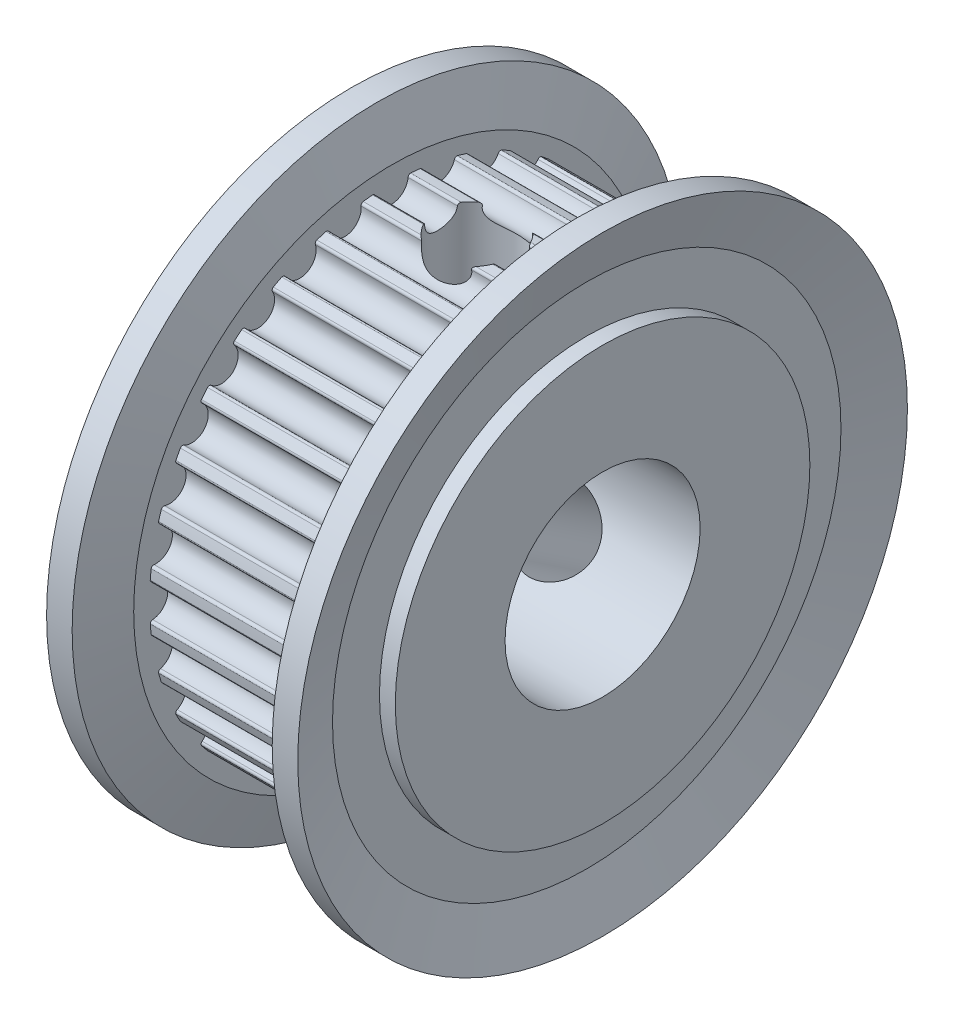
from build123d import *

# Parameters (mm, degrees)
CUT_EXTRUDE1_DEPTH       = 3.5
CUT_EXTRUDE1_DEPTH_BACK  = 3.5
CUT_EXTRUDE2_DEPTH       = 3.5
CUT_EXTRUDE2_DEPTH_BACK  = 3.5
CUT_EXTRUDE3_DEPTH       = 3.5
CUT_EXTRUDE3_DEPTH_BACK  = 3.5
CUT_EXTRUDE4_DEPTH       = 3.5
CUT_EXTRUDE4_DEPTH_BACK  = 3.5
CUT_EXTRUDE5_DEPTH       = 3.5
CUT_EXTRUDE5_DEPTH_BACK  = 3.5
CUT_EXTRUDE6_DEPTH       = 3.5
CUT_EXTRUDE6_DEPTH_BACK  = 3.5
CUT_EXTRUDE7_DEPTH       = 3.5
CUT_EXTRUDE7_DEPTH_BACK  = 3.5
CUT_EXTRUDE8_DEPTH       = 3.5
CUT_EXTRUDE8_DEPTH_BACK  = 3.5
CUT_EXTRUDE9_DEPTH       = 3.5
CUT_EXTRUDE9_DEPTH_BACK  = 3.5
CUT_EXTRUDE10_DEPTH      = 3.5
CUT_EXTRUDE10_DEPTH_BACK = 3.5
CUT_EXTRUDE11_DEPTH      = 3.5
CUT_EXTRUDE11_DEPTH_BACK = 3.5
CUT_EXTRUDE12_DEPTH      = 3.5
CUT_EXTRUDE12_DEPTH_BACK = 3.5
CUT_EXTRUDE13_DEPTH      = 3.5
CUT_EXTRUDE13_DEPTH_BACK = 3.5
CUT_EXTRUDE14_DEPTH      = 3.5
CUT_EXTRUDE14_DEPTH_BACK = 3.5
CUT_EXTRUDE15_DEPTH      = 3.5
CUT_EXTRUDE15_DEPTH_BACK = 3.5
CUT_EXTRUDE16_DEPTH      = 3.5
CUT_EXTRUDE16_DEPTH_BACK = 3.5
CUT_EXTRUDE17_DEPTH      = 3.5
CUT_EXTRUDE17_DEPTH_BACK = 3.5
CUT_EXTRUDE18_DEPTH      = 3.5
CUT_EXTRUDE18_DEPTH_BACK = 3.5
CUT_EXTRUDE19_DEPTH      = 3.5
CUT_EXTRUDE19_DEPTH_BACK = 3.5
CUT_EXTRUDE20_DEPTH      = 3.5
CUT_EXTRUDE20_DEPTH_BACK = 3.5
CUT_EXTRUDE21_DEPTH      = 3.5
CUT_EXTRUDE21_DEPTH_BACK = 3.5
CUT_EXTRUDE22_DEPTH      = 3.5
CUT_EXTRUDE22_DEPTH_BACK = 3.5
CUT_EXTRUDE23_DEPTH      = 3.5
CUT_EXTRUDE23_DEPTH_BACK = 3.5
CUT_EXTRUDE24_DEPTH      = 3.5
CUT_EXTRUDE24_DEPTH_BACK = 3.5
CUT_EXTRUDE25_DEPTH      = 3.5
CUT_EXTRUDE25_DEPTH_BACK = 3.5
CUT_EXTRUDE26_DEPTH      = 3.5
CUT_EXTRUDE26_DEPTH_BACK = 3.5
CUT_EXTRUDE27_DEPTH      = 3.5
CUT_EXTRUDE27_DEPTH_BACK = 3.5
CUT_EXTRUDE28_DEPTH      = 3.5
CUT_EXTRUDE28_DEPTH_BACK = 3.5
CUT_EXTRUDE29_DEPTH      = 3.5
CUT_EXTRUDE29_DEPTH_BACK = 3.5
CUT_EXTRUDE30_DEPTH      = 3.5
CUT_EXTRUDE30_DEPTH_BACK = 3.5
CUT_EXTRUDE31_DEPTH      = 3.5
CUT_EXTRUDE31_DEPTH_BACK = 3.5
CUT_EXTRUDE32_DEPTH      = 3.5
CUT_EXTRUDE32_DEPTH_BACK = 3.5
SKETCH36_W               = 10.3
SKETCH36_H               = 4
SKETCH37_W               = 1.621
SKETCH37_H               = 9.93


with BuildPart() as part:
    # Sketch1 → Revolve1 (revolve)
    with BuildSketch(Plane.XY, mode=Mode.PRIVATE) as revolve1_sk:
        Polygon((-5.15, 0), (-5.15, 8.5), (-3.5, 8.5), (-3.5, 9.93), (3.5, 9.93), (3.5, 8.5), (5.15, 8.5), (5.15, 0), align=None)
    revolve(revolve1_sk.sketch.rotate(Axis((5.15, 0, 0), (-1, 0, 0)), 270), axis=Axis((5.15, 0, 0), (-1, 0, 0)))

    # Sketch2 → Cut-Extrude1 (cut, two sides: drawn at the far end of the back side and taken through both)
    with BuildSketch(Plane(origin=(0, 0, 0), x_dir=(0, 0, -1), z_dir=(1, 0, 0)).offset(-CUT_EXTRUDE1_DEPTH_BACK)):
        with BuildLine():
            Line((-0.950908352, 10.140512724), (-0.927279331, 9.888532197))
            Line((-0.927279331, 9.888532197), (-0.792969158, 9.89929093))
            ThreePointArc((-0.792969158, 9.89929093), (-0.711706778, 9.873169891), (-0.672449407, 9.797375816))
            ThreePointArc((-0.672449407, 9.797375816), (-2e-09, 9.181), (0.672449407, 9.797375812))
            ThreePointArc((0.672449407, 9.797375812), (0.711706777, 9.87316989), (0.792969158, 9.89929093))
            Line((0.792969158, 9.89929093), (0.927279331, 9.888532197))
            Line((0.927279331, 9.888532197), (0.950908352, 10.140512724))
            ThreePointArc((0.950908352, 10.140512724), (0, 10.185), (-0.950908352, 10.140512724))
        make_face()
    extrude(amount=CUT_EXTRUDE1_DEPTH + CUT_EXTRUDE1_DEPTH_BACK, mode=Mode.SUBTRACT)

    # Sketch3 → Cut-Extrude2 (cut, two sides: drawn at the far end of the back side and taken through both)
    with BuildSketch(Plane(origin=(0, 0, 0), x_dir=(0, 0, -1), z_dir=(1, 0, 0)).offset(-CUT_EXTRUDE2_DEPTH_BACK)):
        with BuildLine():
            Line((-2.910952807, 9.760152599), (-2.838618849, 9.5176236))
            Line((-2.838618849, 9.5176236), (-2.708988333, 9.554378222))
            ThreePointArc((-2.708988333, 9.554378222), (-2.624191426, 9.544612596), (-2.570901683, 9.477933616))
            ThreePointArc((-2.570901683, 9.477933616), (-1.791124249, 9.004589659), (-1.251844722, 9.740310354))
            ThreePointArc((-1.251844722, 9.740310354), (-1.228128363, 9.822306803), (-1.153523377, 9.863779439))
            Line((-1.153523377, 9.863779439), (-1.019695012, 9.879430047))
            Line((-1.019695012, 9.879430047), (-1.045678978, 10.131178632))
            ThreePointArc((-1.045678978, 10.131178632), (-1.98699493, 9.989298081), (-2.910952807, 9.760152599))
        make_face()
    extrude(amount=CUT_EXTRUDE2_DEPTH + CUT_EXTRUDE2_DEPTH_BACK, mode=Mode.SUBTRACT)

    # Sketch4 → Cut-Extrude3 (cut, two sides: drawn at the far end of the back side and taken through both)
    with BuildSketch(Plane(origin=(0, 0, 0), x_dir=(0, 0, -1), z_dir=(1, 0, 0)).offset(-CUT_EXTRUDE3_DEPTH_BACK)):
        with BuildLine():
            Line((-4.759130979, 9.004715283), (-4.640871837, 8.780958066))
            Line((-4.640871837, 8.780958066), (-4.520902606, 8.842296117))
            ThreePointArc((-4.520902606, 8.842296117), (-4.435829868, 8.849261191), (-4.370555649, 8.794259742))
            ThreePointArc((-4.370555649, 8.794259742), (-3.513416595, 8.482137987), (-3.12803116, 9.308930232))
            ThreePointArc((-3.12803116, 9.308930232), (-3.120767218, 9.393977974), (-3.055686656, 9.449208436))
            Line((-3.055686656, 9.449208436), (-2.927483047, 9.490666941))
            Line((-2.927483047, 9.490666941), (-3.002081451, 9.732509027))
            ThreePointArc((-3.002081451, 9.732509027), (-3.897630759, 9.409713039), (-4.759130979, 9.004715283))
        make_face()
    extrude(amount=CUT_EXTRUDE3_DEPTH + CUT_EXTRUDE3_DEPTH_BACK, mode=Mode.SUBTRACT)

    # Sketch5 → Cut-Extrude4 (cut, two sides: drawn at the far end of the back side and taken through both)
    with BuildSketch(Plane(origin=(0, 0, 0), x_dir=(0, 0, -1), z_dir=(1, 0, 0)).offset(-CUT_EXTRUDE4_DEPTH_BACK)):
        with BuildLine():
            Line((-6.424418416, 7.903231808), (-6.264778723, 7.706845238))
            Line((-6.264778723, 7.706845238), (-6.159081127, 7.790409532))
            ThreePointArc((-6.159081127, 7.790409532), (-6.077001856, 7.813837641), (-6.002251613, 7.772627398))
            ThreePointArc((-6.002251613, 7.772627398), (-5.100690311, 7.633722509), (-4.884009115, 8.519813141))
            ThreePointArc((-4.884009115, 8.519813141), (-4.893476739, 8.60464384), (-4.84042161, 8.671509651))
            Line((-4.84042161, 8.671509651), (-4.722769551, 8.737182826))
            Line((-4.722769551, 8.737182826), (-4.843115618, 8.959824558))
            ThreePointArc((-4.843115618, 8.959824558), (-5.658482823, 8.468518001), (-6.424418416, 7.903231808))
        make_face()
    extrude(amount=CUT_EXTRUDE4_DEPTH + CUT_EXTRUDE4_DEPTH_BACK, mode=Mode.SUBTRACT)

    # Sketch6 → Cut-Extrude5 (cut, two sides: drawn at the far end of the back side and taken through both)
    with BuildSketch(Plane(origin=(0, 0, 0), x_dir=(0, 0, -1), z_dir=(1, 0, 0)).offset(-CUT_EXTRUDE5_DEPTH_BACK)):
        with BuildLine():
            Line((-7.842819056, 6.498031568), (-7.647933676, 6.33656267))
            Line((-7.647933676, 6.33656267), (-7.560569614, 6.439141876))
            ThreePointArc((-7.560569614, 6.439141876), (-7.484638071, 6.478132693), (-7.403284413, 6.452297342))
            ThreePointArc((-7.403284413, 6.452297342), (-6.49194736, 6.491947357), (-6.452297339, 7.40328441))
            ThreePointArc((-6.452297339, 7.40328441), (-6.478132693, 7.484638069), (-6.439141876, 7.560569614))
            Line((-6.439141876, 7.560569614), (-6.33656267, 7.647933676))
            Line((-6.33656267, 7.647933676), (-6.498031568, 7.842819056))
            ThreePointArc((-6.498031568, 7.842819056), (-7.201882566, 7.201882566), (-7.842819056, 6.498031568))
        make_face()
    extrude(amount=CUT_EXTRUDE5_DEPTH + CUT_EXTRUDE5_DEPTH_BACK, mode=Mode.SUBTRACT)

    # Sketch7 → Cut-Extrude6 (cut, two sides: drawn at the far end of the back side and taken through both)
    with BuildSketch(Plane(origin=(0, 0, 0), x_dir=(0, 0, -1), z_dir=(1, 0, 0)).offset(-CUT_EXTRUDE6_DEPTH_BACK)):
        with BuildLine():
            Line((-8.959824558, 4.843115618), (-8.737182826, 4.722769551))
            Line((-8.737182826, 4.722769551), (-8.671509651, 4.84042161))
            ThreePointArc((-8.671509651, 4.84042161), (-8.604643842, 4.893476738), (-8.519813145, 4.884009117))
            ThreePointArc((-8.519813145, 4.884009117), (-7.633722512, 5.100690308), (-7.772627394, 6.00225161))
            ThreePointArc((-7.772627394, 6.00225161), (-7.813837641, 6.077001854), (-7.790409532, 6.159081127))
            Line((-7.790409532, 6.159081127), (-7.706845238, 6.264778723))
            Line((-7.706845238, 6.264778723), (-7.903231808, 6.424418416))
            ThreePointArc((-7.903231808, 6.424418416), (-8.468518001, 5.658482823), (-8.959824558, 4.843115618))
        make_face()
    extrude(amount=CUT_EXTRUDE6_DEPTH + CUT_EXTRUDE6_DEPTH_BACK, mode=Mode.SUBTRACT)

    # Sketch8 → Cut-Extrude7 (cut, two sides: drawn at the far end of the back side and taken through both)
    with BuildSketch(Plane(origin=(0, 0, 0), x_dir=(0, 0, -1), z_dir=(1, 0, 0)).offset(-CUT_EXTRUDE7_DEPTH_BACK)):
        with BuildLine():
            Line((-9.732509027, 3.002081451), (-9.490666941, 2.927483047))
            Line((-9.490666941, 2.927483047), (-9.449208436, 3.055686656))
            ThreePointArc((-9.449208436, 3.055686656), (-9.393977976, 3.120767217), (-9.308930236, 3.128031162))
            ThreePointArc((-9.308930236, 3.128031162), (-8.482137989, 3.513416591), (-8.794259738, 4.370555647))
            ThreePointArc((-8.794259738, 4.370555647), (-8.84926119, 4.435829866), (-8.842296117, 4.520902606))
            Line((-8.842296117, 4.520902606), (-8.780958066, 4.640871837))
            Line((-8.780958066, 4.640871837), (-9.004715283, 4.759130979))
            ThreePointArc((-9.004715283, 4.759130979), (-9.409713039, 3.897630759), (-9.732509027, 3.002081451))
        make_face()
    extrude(amount=CUT_EXTRUDE7_DEPTH + CUT_EXTRUDE7_DEPTH_BACK, mode=Mode.SUBTRACT)

    # Sketch9 → Cut-Extrude8 (cut, two sides: drawn at the far end of the back side and taken through both)
    with BuildSketch(Plane(origin=(0, 0, 0), x_dir=(0, 0, -1), z_dir=(1, 0, 0)).offset(-CUT_EXTRUDE8_DEPTH_BACK)):
        with BuildLine():
            Line((-10.131178632, 1.045678978), (-9.879430047, 1.019695012))
            Line((-9.879430047, 1.019695012), (-9.863779439, 1.153523377))
            ThreePointArc((-9.863779439, 1.153523377), (-9.822306805, 1.228128361), (-9.740310358, 1.251844723))
            ThreePointArc((-9.740310358, 1.251844723), (-9.00458966, 1.791124244), (-9.477933611, 2.570901682))
            ThreePointArc((-9.477933611, 2.570901682), (-9.544612594, 2.624191424), (-9.554378222, 2.708988333))
            Line((-9.554378222, 2.708988333), (-9.5176236, 2.838618849))
            Line((-9.5176236, 2.838618849), (-9.760152599, 2.910952807))
            ThreePointArc((-9.760152599, 2.910952807), (-9.989298081, 1.98699493), (-10.131178632, 1.045678978))
        make_face()
    extrude(amount=CUT_EXTRUDE8_DEPTH + CUT_EXTRUDE8_DEPTH_BACK, mode=Mode.SUBTRACT)

    # Sketch10 → Cut-Extrude9 (cut, two sides: drawn at the far end of the back side and taken through both)
    with BuildSketch(Plane(origin=(0, 0, 0), x_dir=(0, 0, -1), z_dir=(1, 0, 0)).offset(-CUT_EXTRUDE9_DEPTH_BACK)):
        with BuildLine():
            Line((-10.140512724, -0.950908352), (-9.888532197, -0.927279331))
            Line((-9.888532197, -0.927279331), (-9.89929093, -0.792969158))
            ThreePointArc((-9.89929093, -0.792969158), (-9.873169891, -0.711706778), (-9.797375816, -0.672449407))
            ThreePointArc((-9.797375816, -0.672449407), (-9.181, -2e-09), (-9.797375812, 0.672449407))
            ThreePointArc((-9.797375812, 0.672449407), (-9.87316989, 0.711706777), (-9.89929093, 0.792969158))
            Line((-9.89929093, 0.792969158), (-9.888532197, 0.927279331))
            Line((-9.888532197, 0.927279331), (-10.140512724, 0.950908352))
            ThreePointArc((-10.140512724, 0.950908352), (-10.185, 0), (-10.140512724, -0.950908352))
        make_face()
    extrude(amount=CUT_EXTRUDE9_DEPTH + CUT_EXTRUDE9_DEPTH_BACK, mode=Mode.SUBTRACT)

    # Sketch11 → Cut-Extrude10 (cut, two sides: drawn at the far end of the back side and taken through both)
    with BuildSketch(Plane(origin=(0, 0, 0), x_dir=(0, 0, -1), z_dir=(1, 0, 0)).offset(-CUT_EXTRUDE10_DEPTH_BACK)):
        with BuildLine():
            Line((-9.760152599, -2.910952807), (-9.5176236, -2.838618849))
            Line((-9.5176236, -2.838618849), (-9.554378222, -2.708988333))
            ThreePointArc((-9.554378222, -2.708988333), (-9.544612596, -2.624191426), (-9.477933616, -2.570901683))
            ThreePointArc((-9.477933616, -2.570901683), (-9.004589659, -1.791124249), (-9.740310354, -1.251844722))
            ThreePointArc((-9.740310354, -1.251844722), (-9.822306803, -1.228128363), (-9.863779439, -1.153523377))
            Line((-9.863779439, -1.153523377), (-9.879430047, -1.019695012))
            Line((-9.879430047, -1.019695012), (-10.131178632, -1.045678978))
            ThreePointArc((-10.131178632, -1.045678978), (-9.989298081, -1.98699493), (-9.760152599, -2.910952807))
        make_face()
    extrude(amount=CUT_EXTRUDE10_DEPTH + CUT_EXTRUDE10_DEPTH_BACK, mode=Mode.SUBTRACT)

    # Sketch12 → Cut-Extrude11 (cut, two sides: drawn at the far end of the back side and taken through both)
    with BuildSketch(Plane(origin=(0, 0, 0), x_dir=(0, 0, -1), z_dir=(1, 0, 0)).offset(-CUT_EXTRUDE11_DEPTH_BACK)):
        with BuildLine():
            Line((-9.004715283, -4.759130979), (-8.780958066, -4.640871837))
            Line((-8.780958066, -4.640871837), (-8.842296117, -4.520902606))
            ThreePointArc((-8.842296117, -4.520902606), (-8.849261191, -4.435829868), (-8.794259742, -4.370555649))
            ThreePointArc((-8.794259742, -4.370555649), (-8.482137987, -3.513416595), (-9.308930232, -3.12803116))
            ThreePointArc((-9.308930232, -3.12803116), (-9.393977974, -3.120767218), (-9.449208436, -3.055686656))
            Line((-9.449208436, -3.055686656), (-9.490666941, -2.927483047))
            Line((-9.490666941, -2.927483047), (-9.732509027, -3.002081451))
            ThreePointArc((-9.732509027, -3.002081451), (-9.409713039, -3.897630759), (-9.004715283, -4.759130979))
        make_face()
    extrude(amount=CUT_EXTRUDE11_DEPTH + CUT_EXTRUDE11_DEPTH_BACK, mode=Mode.SUBTRACT)

    # Sketch13 → Cut-Extrude12 (cut, two sides: drawn at the far end of the back side and taken through both)
    with BuildSketch(Plane(origin=(0, 0, 0), x_dir=(0, 0, -1), z_dir=(1, 0, 0)).offset(-CUT_EXTRUDE12_DEPTH_BACK)):
        with BuildLine():
            Line((-7.903231808, -6.424418416), (-7.706845238, -6.264778723))
            Line((-7.706845238, -6.264778723), (-7.790409532, -6.159081127))
            ThreePointArc((-7.790409532, -6.159081127), (-7.813837641, -6.077001856), (-7.772627398, -6.002251613))
            ThreePointArc((-7.772627398, -6.002251613), (-7.633722509, -5.100690311), (-8.519813141, -4.884009115))
            ThreePointArc((-8.519813141, -4.884009115), (-8.60464384, -4.893476739), (-8.671509651, -4.84042161))
            Line((-8.671509651, -4.84042161), (-8.737182826, -4.722769551))
            Line((-8.737182826, -4.722769551), (-8.959824558, -4.843115618))
            ThreePointArc((-8.959824558, -4.843115618), (-8.468518001, -5.658482823), (-7.903231808, -6.424418416))
        make_face()
    extrude(amount=CUT_EXTRUDE12_DEPTH + CUT_EXTRUDE12_DEPTH_BACK, mode=Mode.SUBTRACT)

    # Sketch14 → Cut-Extrude13 (cut, two sides: drawn at the far end of the back side and taken through both)
    with BuildSketch(Plane(origin=(0, 0, 0), x_dir=(0, 0, -1), z_dir=(1, 0, 0)).offset(-CUT_EXTRUDE13_DEPTH_BACK)):
        with BuildLine():
            Line((-6.498031568, -7.842819056), (-6.33656267, -7.647933676))
            Line((-6.33656267, -7.647933676), (-6.439141876, -7.560569614))
            ThreePointArc((-6.439141876, -7.560569614), (-6.478132693, -7.484638071), (-6.452297342, -7.403284413))
            ThreePointArc((-6.452297342, -7.403284413), (-6.491947357, -6.49194736), (-7.40328441, -6.452297339))
            ThreePointArc((-7.40328441, -6.452297339), (-7.484638069, -6.478132693), (-7.560569614, -6.439141876))
            Line((-7.560569614, -6.439141876), (-7.647933676, -6.33656267))
            Line((-7.647933676, -6.33656267), (-7.842819056, -6.498031568))
            ThreePointArc((-7.842819056, -6.498031568), (-7.201882566, -7.201882566), (-6.498031568, -7.842819056))
        make_face()
    extrude(amount=CUT_EXTRUDE13_DEPTH + CUT_EXTRUDE13_DEPTH_BACK, mode=Mode.SUBTRACT)

    # Sketch15 → Cut-Extrude14 (cut, two sides: drawn at the far end of the back side and taken through both)
    with BuildSketch(Plane(origin=(0, 0, 0), x_dir=(0, 0, -1), z_dir=(1, 0, 0)).offset(-CUT_EXTRUDE14_DEPTH_BACK)):
        with BuildLine():
            Line((-4.843115618, -8.959824558), (-4.722769551, -8.737182826))
            Line((-4.722769551, -8.737182826), (-4.84042161, -8.671509651))
            ThreePointArc((-4.84042161, -8.671509651), (-4.893476738, -8.604643842), (-4.884009117, -8.519813145))
            ThreePointArc((-4.884009117, -8.519813145), (-5.100690308, -7.633722512), (-6.00225161, -7.772627394))
            ThreePointArc((-6.00225161, -7.772627394), (-6.077001854, -7.813837641), (-6.159081127, -7.790409532))
            Line((-6.159081127, -7.790409532), (-6.264778723, -7.706845238))
            Line((-6.264778723, -7.706845238), (-6.424418416, -7.903231808))
            ThreePointArc((-6.424418416, -7.903231808), (-5.658482823, -8.468518001), (-4.843115618, -8.959824558))
        make_face()
    extrude(amount=CUT_EXTRUDE14_DEPTH + CUT_EXTRUDE14_DEPTH_BACK, mode=Mode.SUBTRACT)

    # Sketch16 → Cut-Extrude15 (cut, two sides: drawn at the far end of the back side and taken through both)
    with BuildSketch(Plane(origin=(0, 0, 0), x_dir=(0, 0, -1), z_dir=(1, 0, 0)).offset(-CUT_EXTRUDE15_DEPTH_BACK)):
        with BuildLine():
            Line((-3.002081451, -9.732509027), (-2.927483047, -9.490666941))
            Line((-2.927483047, -9.490666941), (-3.055686656, -9.449208436))
            ThreePointArc((-3.055686656, -9.449208436), (-3.120767217, -9.393977976), (-3.128031162, -9.308930236))
            ThreePointArc((-3.128031162, -9.308930236), (-3.513416591, -8.482137989), (-4.370555647, -8.794259738))
            ThreePointArc((-4.370555647, -8.794259738), (-4.435829866, -8.84926119), (-4.520902606, -8.842296117))
            Line((-4.520902606, -8.842296117), (-4.640871837, -8.780958066))
            Line((-4.640871837, -8.780958066), (-4.759130979, -9.004715283))
            ThreePointArc((-4.759130979, -9.004715283), (-3.897630759, -9.409713039), (-3.002081451, -9.732509027))
        make_face()
    extrude(amount=CUT_EXTRUDE15_DEPTH + CUT_EXTRUDE15_DEPTH_BACK, mode=Mode.SUBTRACT)

    # Sketch17 → Cut-Extrude16 (cut, two sides: drawn at the far end of the back side and taken through both)
    with BuildSketch(Plane(origin=(0, 0, 0), x_dir=(0, 0, -1), z_dir=(1, 0, 0)).offset(-CUT_EXTRUDE16_DEPTH_BACK)):
        with BuildLine():
            Line((-1.045678978, -10.131178632), (-1.019695012, -9.879430047))
            Line((-1.019695012, -9.879430047), (-1.153523377, -9.863779439))
            ThreePointArc((-1.153523377, -9.863779439), (-1.228128361, -9.822306805), (-1.251844723, -9.740310358))
            ThreePointArc((-1.251844723, -9.740310358), (-1.791124244, -9.00458966), (-2.570901682, -9.477933611))
            ThreePointArc((-2.570901682, -9.477933611), (-2.624191424, -9.544612594), (-2.708988333, -9.554378222))
            Line((-2.708988333, -9.554378222), (-2.838618849, -9.5176236))
            Line((-2.838618849, -9.5176236), (-2.910952807, -9.760152599))
            ThreePointArc((-2.910952807, -9.760152599), (-1.98699493, -9.989298081), (-1.045678978, -10.131178632))
        make_face()
    extrude(amount=CUT_EXTRUDE16_DEPTH + CUT_EXTRUDE16_DEPTH_BACK, mode=Mode.SUBTRACT)

    # Sketch18 → Cut-Extrude17 (cut, two sides: drawn at the far end of the back side and taken through both)
    with BuildSketch(Plane(origin=(0, 0, 0), x_dir=(0, 0, -1), z_dir=(1, 0, 0)).offset(-CUT_EXTRUDE17_DEPTH_BACK)):
        with BuildLine():
            Line((0.950908352, -10.140512724), (0.927279331, -9.888532197))
            Line((0.927279331, -9.888532197), (0.792969158, -9.89929093))
            ThreePointArc((0.792969158, -9.89929093), (0.711706778, -9.873169891), (0.672449407, -9.797375816))
            ThreePointArc((0.672449407, -9.797375816), (2e-09, -9.181), (-0.672449407, -9.797375812))
            ThreePointArc((-0.672449407, -9.797375812), (-0.711706777, -9.87316989), (-0.792969158, -9.89929093))
            Line((-0.792969158, -9.89929093), (-0.927279331, -9.888532197))
            Line((-0.927279331, -9.888532197), (-0.950908352, -10.140512724))
            ThreePointArc((-0.950908352, -10.140512724), (0, -10.185), (0.950908352, -10.140512724))
        make_face()
    extrude(amount=CUT_EXTRUDE17_DEPTH + CUT_EXTRUDE17_DEPTH_BACK, mode=Mode.SUBTRACT)

    # Sketch19 → Cut-Extrude18 (cut, two sides: drawn at the far end of the back side and taken through both)
    with BuildSketch(Plane(origin=(0, 0, 0), x_dir=(0, 0, -1), z_dir=(1, 0, 0)).offset(-CUT_EXTRUDE18_DEPTH_BACK)):
        with BuildLine():
            Line((2.910952807, -9.760152599), (2.838618849, -9.5176236))
            Line((2.838618849, -9.5176236), (2.708988333, -9.554378222))
            ThreePointArc((2.708988333, -9.554378222), (2.624191426, -9.544612596), (2.570901683, -9.477933616))
            ThreePointArc((2.570901683, -9.477933616), (1.791124249, -9.004589659), (1.251844722, -9.740310354))
            ThreePointArc((1.251844722, -9.740310354), (1.228128363, -9.822306803), (1.153523377, -9.863779439))
            Line((1.153523377, -9.863779439), (1.019695012, -9.879430047))
            Line((1.019695012, -9.879430047), (1.045678978, -10.131178632))
            ThreePointArc((1.045678978, -10.131178632), (1.98699493, -9.989298081), (2.910952807, -9.760152599))
        make_face()
    extrude(amount=CUT_EXTRUDE18_DEPTH + CUT_EXTRUDE18_DEPTH_BACK, mode=Mode.SUBTRACT)

    # Sketch20 → Cut-Extrude19 (cut, two sides: drawn at the far end of the back side and taken through both)
    with BuildSketch(Plane(origin=(0, 0, 0), x_dir=(0, 0, -1), z_dir=(1, 0, 0)).offset(-CUT_EXTRUDE19_DEPTH_BACK)):
        with BuildLine():
            Line((4.759130979, -9.004715283), (4.640871837, -8.780958066))
            Line((4.640871837, -8.780958066), (4.520902606, -8.842296117))
            ThreePointArc((4.520902606, -8.842296117), (4.435829868, -8.849261191), (4.370555649, -8.794259742))
            ThreePointArc((4.370555649, -8.794259742), (3.513416595, -8.482137987), (3.12803116, -9.308930232))
            ThreePointArc((3.12803116, -9.308930232), (3.120767218, -9.393977974), (3.055686656, -9.449208436))
            Line((3.055686656, -9.449208436), (2.927483047, -9.490666941))
            Line((2.927483047, -9.490666941), (3.002081451, -9.732509027))
            ThreePointArc((3.002081451, -9.732509027), (3.897630759, -9.409713039), (4.759130979, -9.004715283))
        make_face()
    extrude(amount=CUT_EXTRUDE19_DEPTH + CUT_EXTRUDE19_DEPTH_BACK, mode=Mode.SUBTRACT)

    # Sketch21 → Cut-Extrude20 (cut, two sides: drawn at the far end of the back side and taken through both)
    with BuildSketch(Plane(origin=(0, 0, 0), x_dir=(0, 0, -1), z_dir=(1, 0, 0)).offset(-CUT_EXTRUDE20_DEPTH_BACK)):
        with BuildLine():
            Line((6.424418416, -7.903231808), (6.264778723, -7.706845238))
            Line((6.264778723, -7.706845238), (6.159081127, -7.790409532))
            ThreePointArc((6.159081127, -7.790409532), (6.077001856, -7.813837641), (6.002251613, -7.772627398))
            ThreePointArc((6.002251613, -7.772627398), (5.100690311, -7.633722509), (4.884009115, -8.519813141))
            ThreePointArc((4.884009115, -8.519813141), (4.893476739, -8.60464384), (4.84042161, -8.671509651))
            Line((4.84042161, -8.671509651), (4.722769551, -8.737182826))
            Line((4.722769551, -8.737182826), (4.843115618, -8.959824558))
            ThreePointArc((4.843115618, -8.959824558), (5.658482823, -8.468518001), (6.424418416, -7.903231808))
        make_face()
    extrude(amount=CUT_EXTRUDE20_DEPTH + CUT_EXTRUDE20_DEPTH_BACK, mode=Mode.SUBTRACT)

    # Sketch22 → Cut-Extrude21 (cut, two sides: drawn at the far end of the back side and taken through both)
    with BuildSketch(Plane(origin=(0, 0, 0), x_dir=(0, 0, -1), z_dir=(1, 0, 0)).offset(-CUT_EXTRUDE21_DEPTH_BACK)):
        with BuildLine():
            Line((7.842819056, -6.498031568), (7.647933676, -6.33656267))
            Line((7.647933676, -6.33656267), (7.560569614, -6.439141876))
            ThreePointArc((7.560569614, -6.439141876), (7.484638071, -6.478132693), (7.403284413, -6.452297342))
            ThreePointArc((7.403284413, -6.452297342), (6.49194736, -6.491947357), (6.452297339, -7.40328441))
            ThreePointArc((6.452297339, -7.40328441), (6.478132693, -7.484638069), (6.439141876, -7.560569614))
            Line((6.439141876, -7.560569614), (6.33656267, -7.647933676))
            Line((6.33656267, -7.647933676), (6.498031568, -7.842819056))
            ThreePointArc((6.498031568, -7.842819056), (7.201882566, -7.201882566), (7.842819056, -6.498031568))
        make_face()
    extrude(amount=CUT_EXTRUDE21_DEPTH + CUT_EXTRUDE21_DEPTH_BACK, mode=Mode.SUBTRACT)

    # Sketch23 → Cut-Extrude22 (cut, two sides: drawn at the far end of the back side and taken through both)
    with BuildSketch(Plane(origin=(0, 0, 0), x_dir=(0, 0, -1), z_dir=(1, 0, 0)).offset(-CUT_EXTRUDE22_DEPTH_BACK)):
        with BuildLine():
            Line((8.959824558, -4.843115618), (8.737182826, -4.722769551))
            Line((8.737182826, -4.722769551), (8.671509651, -4.84042161))
            ThreePointArc((8.671509651, -4.84042161), (8.604643842, -4.893476738), (8.519813145, -4.884009117))
            ThreePointArc((8.519813145, -4.884009117), (7.633722512, -5.100690308), (7.772627394, -6.00225161))
            ThreePointArc((7.772627394, -6.00225161), (7.813837641, -6.077001854), (7.790409532, -6.159081127))
            Line((7.790409532, -6.159081127), (7.706845238, -6.264778723))
            Line((7.706845238, -6.264778723), (7.903231808, -6.424418416))
            ThreePointArc((7.903231808, -6.424418416), (8.468518001, -5.658482823), (8.959824558, -4.843115618))
        make_face()
    extrude(amount=CUT_EXTRUDE22_DEPTH + CUT_EXTRUDE22_DEPTH_BACK, mode=Mode.SUBTRACT)

    # Sketch24 → Cut-Extrude23 (cut, two sides: drawn at the far end of the back side and taken through both)
    with BuildSketch(Plane(origin=(0, 0, 0), x_dir=(0, 0, -1), z_dir=(1, 0, 0)).offset(-CUT_EXTRUDE23_DEPTH_BACK)):
        with BuildLine():
            Line((9.732509027, -3.002081451), (9.490666941, -2.927483047))
            Line((9.490666941, -2.927483047), (9.449208436, -3.055686656))
            ThreePointArc((9.449208436, -3.055686656), (9.393977976, -3.120767217), (9.308930236, -3.128031162))
            ThreePointArc((9.308930236, -3.128031162), (8.482137989, -3.513416591), (8.794259738, -4.370555647))
            ThreePointArc((8.794259738, -4.370555647), (8.84926119, -4.435829866), (8.842296117, -4.520902606))
            Line((8.842296117, -4.520902606), (8.780958066, -4.640871837))
            Line((8.780958066, -4.640871837), (9.004715283, -4.759130979))
            ThreePointArc((9.004715283, -4.759130979), (9.409713039, -3.897630759), (9.732509027, -3.002081451))
        make_face()
    extrude(amount=CUT_EXTRUDE23_DEPTH + CUT_EXTRUDE23_DEPTH_BACK, mode=Mode.SUBTRACT)

    # Sketch25 → Cut-Extrude24 (cut, two sides: drawn at the far end of the back side and taken through both)
    with BuildSketch(Plane(origin=(0, 0, 0), x_dir=(0, 0, -1), z_dir=(1, 0, 0)).offset(-CUT_EXTRUDE24_DEPTH_BACK)):
        with BuildLine():
            Line((10.131178632, -1.045678978), (9.879430047, -1.019695012))
            Line((9.879430047, -1.019695012), (9.863779439, -1.153523377))
            ThreePointArc((9.863779439, -1.153523377), (9.822306805, -1.228128361), (9.740310358, -1.251844723))
            ThreePointArc((9.740310358, -1.251844723), (9.00458966, -1.791124244), (9.477933611, -2.570901682))
            ThreePointArc((9.477933611, -2.570901682), (9.544612594, -2.624191424), (9.554378222, -2.708988333))
            Line((9.554378222, -2.708988333), (9.5176236, -2.838618849))
            Line((9.5176236, -2.838618849), (9.760152599, -2.910952807))
            ThreePointArc((9.760152599, -2.910952807), (9.989298081, -1.98699493), (10.131178632, -1.045678978))
        make_face()
    extrude(amount=CUT_EXTRUDE24_DEPTH + CUT_EXTRUDE24_DEPTH_BACK, mode=Mode.SUBTRACT)

    # Sketch26 → Cut-Extrude25 (cut, two sides: drawn at the far end of the back side and taken through both)
    with BuildSketch(Plane(origin=(0, 0, 0), x_dir=(0, 0, -1), z_dir=(1, 0, 0)).offset(-CUT_EXTRUDE25_DEPTH_BACK)):
        with BuildLine():
            Line((10.140512724, 0.950908352), (9.888532197, 0.927279331))
            Line((9.888532197, 0.927279331), (9.89929093, 0.792969158))
            ThreePointArc((9.89929093, 0.792969158), (9.873169891, 0.711706778), (9.797375816, 0.672449407))
            ThreePointArc((9.797375816, 0.672449407), (9.181, 2e-09), (9.797375812, -0.672449407))
            ThreePointArc((9.797375812, -0.672449407), (9.87316989, -0.711706777), (9.89929093, -0.792969158))
            Line((9.89929093, -0.792969158), (9.888532197, -0.927279331))
            Line((9.888532197, -0.927279331), (10.140512724, -0.950908352))
            ThreePointArc((10.140512724, -0.950908352), (10.185, 0), (10.140512724, 0.950908352))
        make_face()
    extrude(amount=CUT_EXTRUDE25_DEPTH + CUT_EXTRUDE25_DEPTH_BACK, mode=Mode.SUBTRACT)

    # Sketch27 → Cut-Extrude26 (cut, two sides: drawn at the far end of the back side and taken through both)
    with BuildSketch(Plane(origin=(0, 0, 0), x_dir=(0, 0, -1), z_dir=(1, 0, 0)).offset(-CUT_EXTRUDE26_DEPTH_BACK)):
        with BuildLine():
            Line((9.760152599, 2.910952807), (9.5176236, 2.838618849))
            Line((9.5176236, 2.838618849), (9.554378222, 2.708988333))
            ThreePointArc((9.554378222, 2.708988333), (9.544612596, 2.624191426), (9.477933616, 2.570901683))
            ThreePointArc((9.477933616, 2.570901683), (9.004589659, 1.791124249), (9.740310354, 1.251844722))
            ThreePointArc((9.740310354, 1.251844722), (9.822306803, 1.228128363), (9.863779439, 1.153523377))
            Line((9.863779439, 1.153523377), (9.879430047, 1.019695012))
            Line((9.879430047, 1.019695012), (10.131178632, 1.045678978))
            ThreePointArc((10.131178632, 1.045678978), (9.989298081, 1.98699493), (9.760152599, 2.910952807))
        make_face()
    extrude(amount=CUT_EXTRUDE26_DEPTH + CUT_EXTRUDE26_DEPTH_BACK, mode=Mode.SUBTRACT)

    # Sketch28 → Cut-Extrude27 (cut, two sides: drawn at the far end of the back side and taken through both)
    with BuildSketch(Plane(origin=(0, 0, 0), x_dir=(0, 0, -1), z_dir=(1, 0, 0)).offset(-CUT_EXTRUDE27_DEPTH_BACK)):
        with BuildLine():
            Line((9.004715283, 4.759130979), (8.780958066, 4.640871837))
            Line((8.780958066, 4.640871837), (8.842296117, 4.520902606))
            ThreePointArc((8.842296117, 4.520902606), (8.849261191, 4.435829868), (8.794259742, 4.370555649))
            ThreePointArc((8.794259742, 4.370555649), (8.482137987, 3.513416595), (9.308930232, 3.12803116))
            ThreePointArc((9.308930232, 3.12803116), (9.393977974, 3.120767218), (9.449208436, 3.055686656))
            Line((9.449208436, 3.055686656), (9.490666941, 2.927483047))
            Line((9.490666941, 2.927483047), (9.732509027, 3.002081451))
            ThreePointArc((9.732509027, 3.002081451), (9.409713039, 3.897630759), (9.004715283, 4.759130979))
        make_face()
    extrude(amount=CUT_EXTRUDE27_DEPTH + CUT_EXTRUDE27_DEPTH_BACK, mode=Mode.SUBTRACT)

    # Sketch29 → Cut-Extrude28 (cut, two sides: drawn at the far end of the back side and taken through both)
    with BuildSketch(Plane(origin=(0, 0, 0), x_dir=(0, 0, -1), z_dir=(1, 0, 0)).offset(-CUT_EXTRUDE28_DEPTH_BACK)):
        with BuildLine():
            Line((7.903231808, 6.424418416), (7.706845238, 6.264778723))
            Line((7.706845238, 6.264778723), (7.790409532, 6.159081127))
            ThreePointArc((7.790409532, 6.159081127), (7.813837641, 6.077001856), (7.772627398, 6.002251613))
            ThreePointArc((7.772627398, 6.002251613), (7.633722509, 5.100690311), (8.519813141, 4.884009115))
            ThreePointArc((8.519813141, 4.884009115), (8.60464384, 4.893476739), (8.671509651, 4.84042161))
            Line((8.671509651, 4.84042161), (8.737182826, 4.722769551))
            Line((8.737182826, 4.722769551), (8.959824558, 4.843115618))
            ThreePointArc((8.959824558, 4.843115618), (8.468518001, 5.658482823), (7.903231808, 6.424418416))
        make_face()
    extrude(amount=CUT_EXTRUDE28_DEPTH + CUT_EXTRUDE28_DEPTH_BACK, mode=Mode.SUBTRACT)

    # Sketch30 → Cut-Extrude29 (cut, two sides: drawn at the far end of the back side and taken through both)
    with BuildSketch(Plane(origin=(0, 0, 0), x_dir=(0, 0, -1), z_dir=(1, 0, 0)).offset(-CUT_EXTRUDE29_DEPTH_BACK)):
        with BuildLine():
            Line((6.498031568, 7.842819056), (6.33656267, 7.647933676))
            Line((6.33656267, 7.647933676), (6.439141876, 7.560569614))
            ThreePointArc((6.439141876, 7.560569614), (6.478132693, 7.484638071), (6.452297342, 7.403284413))
            ThreePointArc((6.452297342, 7.403284413), (6.491947357, 6.49194736), (7.40328441, 6.452297339))
            ThreePointArc((7.40328441, 6.452297339), (7.484638069, 6.478132693), (7.560569614, 6.439141876))
            Line((7.560569614, 6.439141876), (7.647933676, 6.33656267))
            Line((7.647933676, 6.33656267), (7.842819056, 6.498031568))
            ThreePointArc((7.842819056, 6.498031568), (7.201882566, 7.201882566), (6.498031568, 7.842819056))
        make_face()
    extrude(amount=CUT_EXTRUDE29_DEPTH + CUT_EXTRUDE29_DEPTH_BACK, mode=Mode.SUBTRACT)

    # Sketch31 → Cut-Extrude30 (cut, two sides: drawn at the far end of the back side and taken through both)
    with BuildSketch(Plane(origin=(0, 0, 0), x_dir=(0, 0, -1), z_dir=(1, 0, 0)).offset(-CUT_EXTRUDE30_DEPTH_BACK)):
        with BuildLine():
            Line((4.843115618, 8.959824558), (4.722769551, 8.737182826))
            Line((4.722769551, 8.737182826), (4.84042161, 8.671509651))
            ThreePointArc((4.84042161, 8.671509651), (4.893476738, 8.604643842), (4.884009117, 8.519813145))
            ThreePointArc((4.884009117, 8.519813145), (5.100690308, 7.633722512), (6.00225161, 7.772627394))
            ThreePointArc((6.00225161, 7.772627394), (6.077001854, 7.813837641), (6.159081127, 7.790409532))
            Line((6.159081127, 7.790409532), (6.264778723, 7.706845238))
            Line((6.264778723, 7.706845238), (6.424418416, 7.903231808))
            ThreePointArc((6.424418416, 7.903231808), (5.658482823, 8.468518001), (4.843115618, 8.959824558))
        make_face()
    extrude(amount=CUT_EXTRUDE30_DEPTH + CUT_EXTRUDE30_DEPTH_BACK, mode=Mode.SUBTRACT)

    # Sketch32 → Cut-Extrude31 (cut, two sides: drawn at the far end of the back side and taken through both)
    with BuildSketch(Plane(origin=(0, 0, 0), x_dir=(0, 0, -1), z_dir=(1, 0, 0)).offset(-CUT_EXTRUDE31_DEPTH_BACK)):
        with BuildLine():
            Line((3.002081451, 9.732509027), (2.927483047, 9.490666941))
            Line((2.927483047, 9.490666941), (3.055686656, 9.449208436))
            ThreePointArc((3.055686656, 9.449208436), (3.120767217, 9.393977976), (3.128031162, 9.308930236))
            ThreePointArc((3.128031162, 9.308930236), (3.513416591, 8.482137989), (4.370555647, 8.794259738))
            ThreePointArc((4.370555647, 8.794259738), (4.435829866, 8.84926119), (4.520902606, 8.842296117))
            Line((4.520902606, 8.842296117), (4.640871837, 8.780958066))
            Line((4.640871837, 8.780958066), (4.759130979, 9.004715283))
            ThreePointArc((4.759130979, 9.004715283), (3.897630759, 9.409713039), (3.002081451, 9.732509027))
        make_face()
    extrude(amount=CUT_EXTRUDE31_DEPTH + CUT_EXTRUDE31_DEPTH_BACK, mode=Mode.SUBTRACT)

    # Sketch33 → Cut-Extrude32 (cut, two sides: drawn at the far end of the back side and taken through both)
    with BuildSketch(Plane(origin=(0, 0, 0), x_dir=(0, 0, -1), z_dir=(1, 0, 0)).offset(-CUT_EXTRUDE32_DEPTH_BACK)):
        with BuildLine():
            Line((1.045678978, 10.131178632), (1.019695012, 9.879430047))
            Line((1.019695012, 9.879430047), (1.153523377, 9.863779439))
            ThreePointArc((1.153523377, 9.863779439), (1.228128361, 9.822306805), (1.251844723, 9.740310358))
            ThreePointArc((1.251844723, 9.740310358), (1.791124244, 9.00458966), (2.570901682, 9.477933611))
            ThreePointArc((2.570901682, 9.477933611), (2.624191424, 9.544612594), (2.708988333, 9.554378222))
            Line((2.708988333, 9.554378222), (2.838618849, 9.5176236))
            Line((2.838618849, 9.5176236), (2.910952807, 9.760152599))
            ThreePointArc((2.910952807, 9.760152599), (1.98699493, 9.989298081), (1.045678978, 10.131178632))
        make_face()
    extrude(amount=CUT_EXTRUDE32_DEPTH + CUT_EXTRUDE32_DEPTH_BACK, mode=Mode.SUBTRACT)

    # Sketch34 → Revolve2 (revolve)
    with BuildSketch(Plane.XY, mode=Mode.PRIVATE) as revolve2_sk:
        Polygon((3.5, 8.5), (4.5, 8.5), (4.5, 10.425), (5.15, 12.5), (4.102084235, 12.5), (3.5, 10.577961864), align=None)
    revolve(revolve2_sk.sketch.rotate(Axis((50, 0, 0), (-1, 0, 0)), 270), axis=Axis((50, 0, 0), (-1, 0, 0)))

    # Sketch35 → Revolve3 (revolve)
    with BuildSketch(Plane.XY, mode=Mode.PRIVATE) as revolve3_sk:
        Polygon((-5.15, 12.5), (-4.5, 10.425), (-4.5, 8.5), (-3.5, 8.5), (-3.5, 10.577961864), (-4.102084235, 12.5), align=None)
    revolve(revolve3_sk.sketch.rotate(Axis((50, 0, 0), (-1, 0, 0)), 270), axis=Axis((50, 0, 0), (-1, 0, 0)))

    # Sketch36 → Cut-Revolve1 (revolve, cut)
    with BuildSketch(Plane.XY, mode=Mode.PRIVATE) as cut_revolve1_sk:
        with Locations((0, 2)):
            Rectangle(SKETCH36_W, SKETCH36_H)
    revolve(cut_revolve1_sk.sketch.rotate(Axis((5.15, 0, 0), (-1, 0, 0)), 270), axis=Axis((5.15, 0, 0), (-1, 0, 0)), mode=Mode.SUBTRACT)

    # Sketch37 → Cut-Revolve2 (revolve, cut)
    with BuildSketch(Plane(origin=(0, 0, 0), x_dir=(0, 0, -1), z_dir=(1, 0, 0)), mode=Mode.PRIVATE) as cut_revolve2_sk:
        with Locations((0.8105, 4.965)):
            Rectangle(SKETCH37_W, SKETCH37_H)
    revolve(cut_revolve2_sk.sketch.rotate(Axis((0, 0, 0), (0, 1, 0)), 180), axis=Axis((0, 0, 0), (0, 1, 0)), mode=Mode.SUBTRACT)

    # Sketch38 → Cut-Revolve3 (revolve, cut)
    with BuildSketch(Plane(origin=(0, 0, 0), x_dir=(0, 0, -1), z_dir=(1, 0, 0)), mode=Mode.PRIVATE) as cut_revolve3_sk:
        Polygon((8.25649325, -5.516812414), (7.355913902, -6.864624655), (-0.900579348, -1.347812242), (0, 0), align=None)
    revolve(cut_revolve3_sk.sketch.rotate(Axis((0, 0, 0), (0, -0.5555702330196052, -0.8314696123025433)), 180), axis=Axis((0, 0, 0), (0, -0.5555702330196052, -0.8314696123025433)), mode=Mode.SUBTRACT)


solid = part.part
